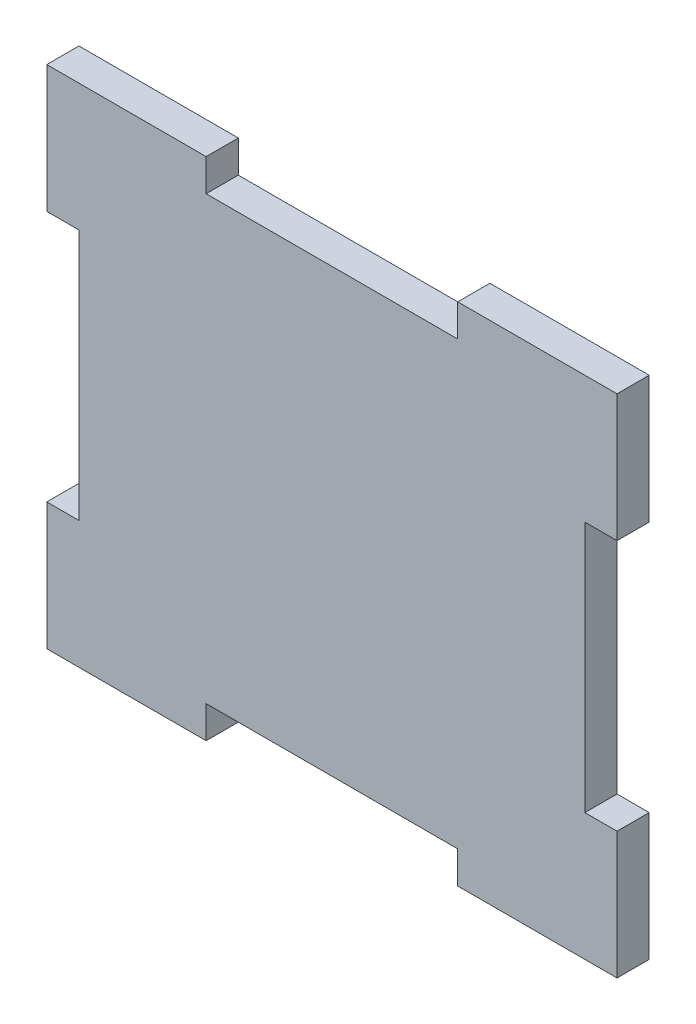
from build123d import *

# Parameters (mm, degrees)
SKETCH1_W           = 112.72
SKETCH1_H           = 100
BOSS_EXTRUDE1_DEPTH = 6.36
SKETCH10_W          = 49.73
SKETCH10_H          = 6.36
CUT_EXTRUDE1_DEPTH  = 76.610179209
SKETCH11_W          = 6.36
SKETCH11_H          = 49.73
CUT_EXTRUDE2_DEPTH  = 76.610179209


with BuildPart() as part:
    # Sketch1 → Boss-Extrude1 (new body)
    with BuildSketch(Plane.XY):
        Rectangle(SKETCH1_W, SKETCH1_H)
    extrude(amount=BOSS_EXTRUDE1_DEPTH)

    # Sketch10 → Cut-Extrude1 (cut, through all)
    with BuildSketch(Plane.XY.offset(6.36)):
        with Locations((0, 46.82)):
            Rectangle(SKETCH10_W, SKETCH10_H)
    cut_extrude1 = extrude(amount=-CUT_EXTRUDE1_DEPTH, mode=Mode.SUBTRACT)

    # Mirror6: Cut-Extrude1 across plane
    add(cut_extrude1.mirror(Plane.ZX), mode=Mode.SUBTRACT)

    # Sketch11 → Cut-Extrude2 (cut, through all)
    with BuildSketch(Plane.XY.offset(6.36)):
        with Locations((53.18, 0)):
            Rectangle(SKETCH11_W, SKETCH11_H)
    cut_extrude2 = extrude(amount=-CUT_EXTRUDE2_DEPTH, mode=Mode.SUBTRACT)

    # Mirror7: Cut-Extrude2 across plane
    add(cut_extrude2.mirror(Plane(origin=(0, 0, 0), x_dir=(0, 0, 1), z_dir=(1, 0, 0))), mode=Mode.SUBTRACT)


solid = part.part
